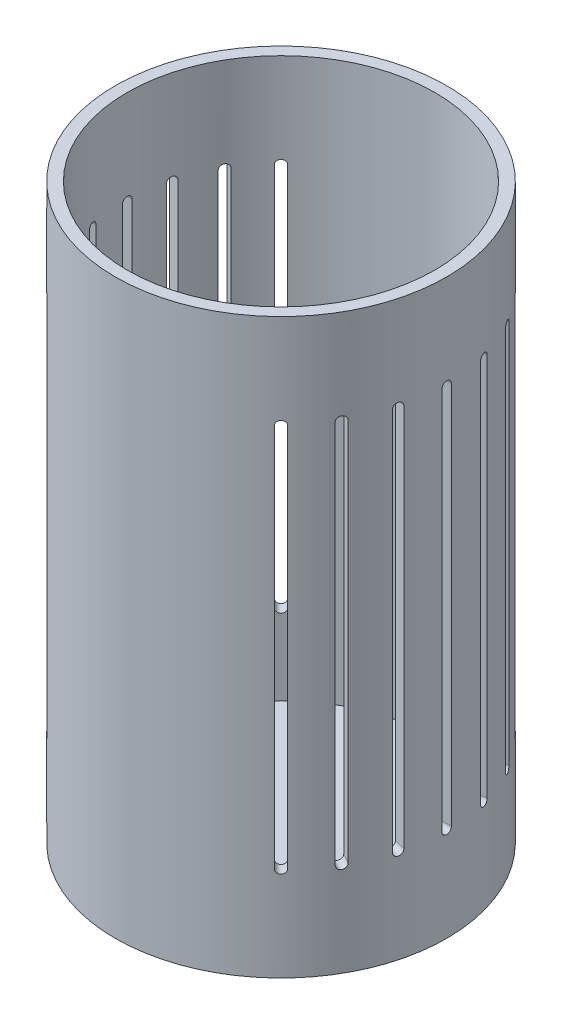
from build123d import *

# Parameters (mm, degrees)
SKETCH1_R                       = 35
SKETCH1_R_2                     = 32.5
BOSS_EXTRUDE1_DEPTH             = 121
SKETCH4_R                       = 32.5
BOSS_EXTRUDE2_DEPTH             = 3
CUT_EXTRUDE1_DEPTH              = 131.732551417
CIRPATTERN1_COUNT               = 4
CIRPATTERN1_ANGLE               = 45
CIRPATTERN1_THE_OTHER_WAY_COUNT = 4
CIRPATTERN1_THE_OTHER_WAY_ANGLE = 45


with BuildPart() as part:
    # Sketch1 → Boss-Extrude1 (new body)
    with BuildSketch(Plane(origin=(0, 0, 0), x_dir=(1, 0, 0), z_dir=(0, 1, 0))):
        with Locations(Location((0, 0, 0), (0, 0, 270))):
            Circle(SKETCH1_R)
        with Locations(Location((0, 0, 0), (0, 0, 270))):
            Circle(SKETCH1_R_2, mode=Mode.SUBTRACT)
    extrude(amount=BOSS_EXTRUDE1_DEPTH)

    # Sketch5 → Cut-Extrude1 (cut, symmetric)
    with BuildSketch(Plane(origin=(0, 0, 0), x_dir=(0, 0, -1), z_dir=(1, 0, 0))):
        with BuildLine():
            Line((1, 101), (1, 20))
            ThreePointArc((1, 20), (0, 19), (-1, 20))
            Line((-1, 20), (-1, 101))
            ThreePointArc((-1, 101), (0, 102), (1, 101))
        make_face()
    cut_extrude1 = extrude(amount=CUT_EXTRUDE1_DEPTH, both=True, mode=Mode.SUBTRACT)

    # CirPattern1: Cut-Extrude1 ×4 about axis
    cirpattern1_axis = Axis((0, 0, 0), (0, -1, 0))
    for i in range(1, CIRPATTERN1_COUNT):
        add(cut_extrude1.rotate(cirpattern1_axis, i * CIRPATTERN1_ANGLE / (CIRPATTERN1_COUNT - 1)), mode=Mode.SUBTRACT)

    # CirPattern1 the other way: Cut-Extrude1 ×4 about axis
    cirpattern1_the_other_way_axis = Axis((0, 0, 0), (0, 1, 0))
    for i in range(1, CIRPATTERN1_THE_OTHER_WAY_COUNT):
        add(cut_extrude1.rotate(cirpattern1_the_other_way_axis, i * CIRPATTERN1_THE_OTHER_WAY_ANGLE / (CIRPATTERN1_THE_OTHER_WAY_COUNT - 1)), mode=Mode.SUBTRACT)


with BuildPart() as body_2:
    # Sketch4 → Boss-Extrude2 (new body)
    with BuildSketch(Plane.XZ):
        with Locations(Location((0, 0, 0), (0, 0, 270))):
            Circle(SKETCH4_R)
    extrude(amount=-BOSS_EXTRUDE2_DEPTH)


solid = Compound([part.part, body_2.part])
